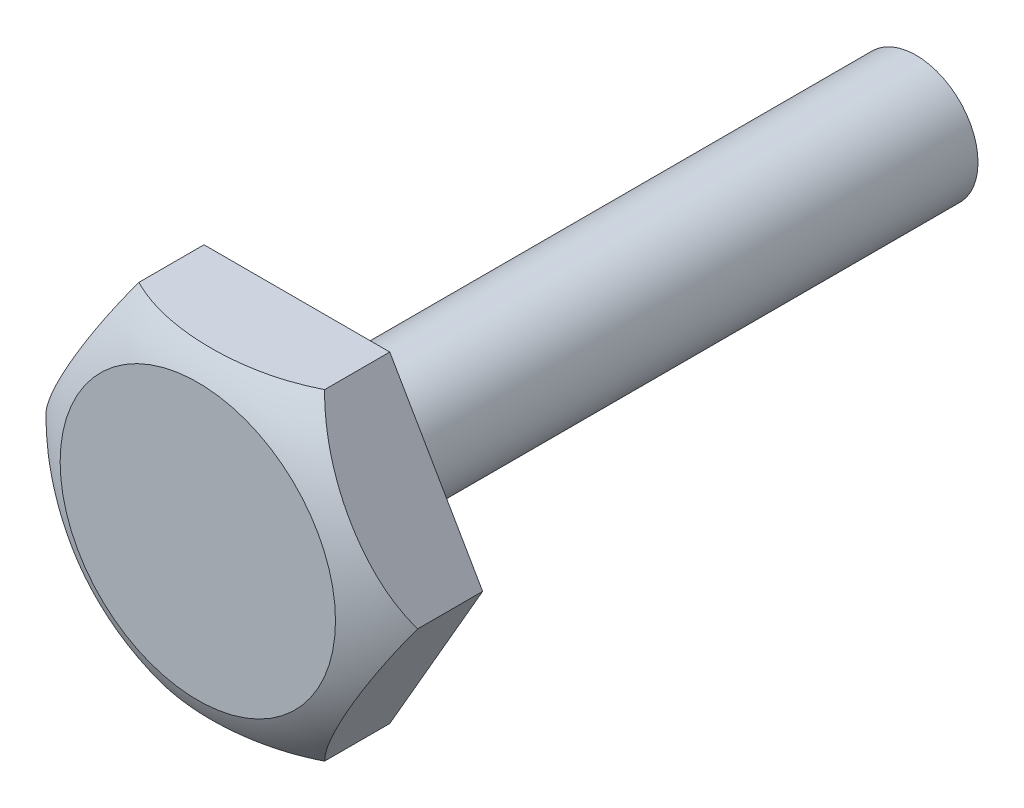
from build123d import *

# Parameters (mm, degrees)
BOSS_EXTRUDE1_DEPTH = 4
SKETCH2_R           = 2.5
BOSS_EXTRUDE2_DEPTH = 25


with BuildPart() as part:
    # Sketch1 → Boss-Extrude1 (new body)
    with BuildSketch(Plane.XY):
        Polygon((7.5, 0), (3.75, 6.495190528), (-3.75, 6.495190528), (-7.5, 0), (-3.75, -6.495190528), (3.75, -6.495190528), align=None)
    extrude(amount=BOSS_EXTRUDE1_DEPTH)

    # Sketch2 → Boss-Extrude2 (add)
    with BuildSketch(Plane.XY):
        Circle(SKETCH2_R)
    extrude(amount=-BOSS_EXTRUDE2_DEPTH)

    # Sketch4 → Cut-Revolve1 (revolve, cut)
    with BuildSketch(Plane(origin=(0, 0, 0), x_dir=(0, 0, -1), z_dir=(1, 0, 0)), mode=Mode.PRIVATE) as cut_revolve1_sk:
        with BuildLine():
            Line((-1.722639627, 8.236577674), (-4.518257709, 8.236577674))
            Line((-4.518257709, 8.236577674), (-4.518257709, 5.392544195))
            Line((-4.518257709, 5.392544195), (-4.073554398, 5.392544195))
            ThreePointArc((-4.073554398, 5.392544195), (-3.104166482, 6.984900617), (-1.722639627, 8.236577674))
        make_face()
    revolve(cut_revolve1_sk.sketch.rotate(Axis((0, 0, 0), (0, 0, 1)), 270), axis=Axis((0, 0, 0), (0, 0, 1)), mode=Mode.SUBTRACT)


solid = part.part
